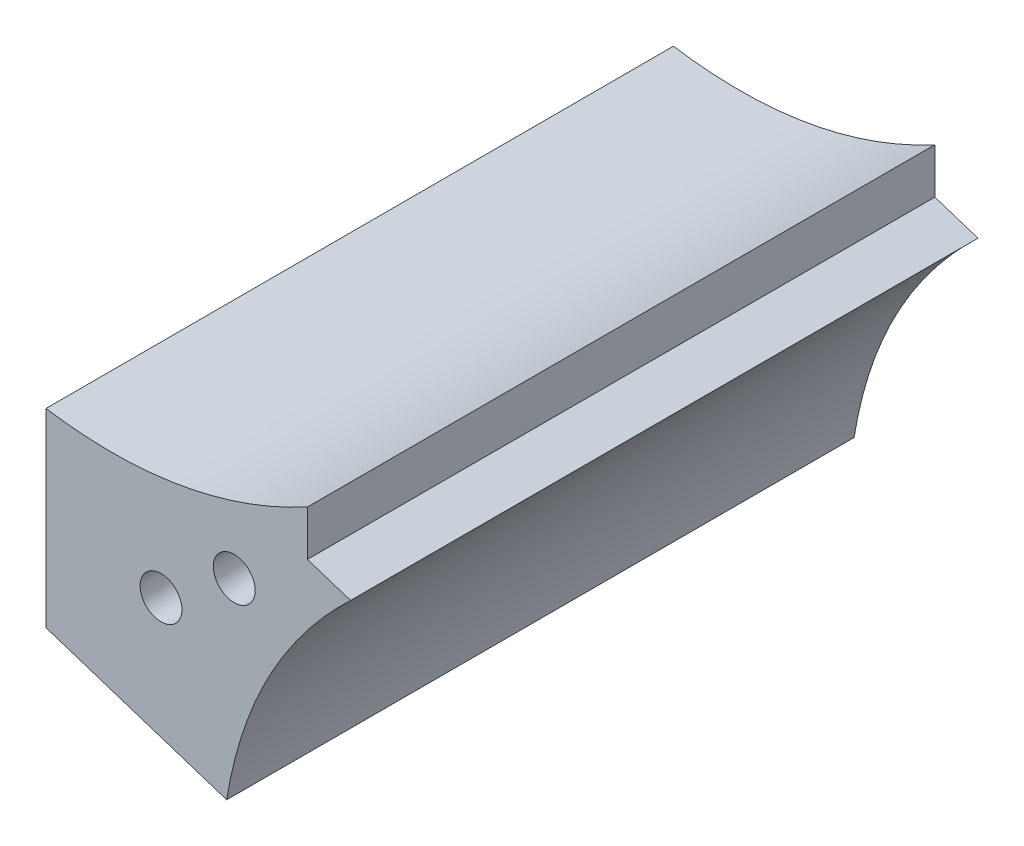
from build123d import *

# Parameters (mm, degrees)
SKETCH_1_R          = 2
EXTRUDE_1_DEPTH     = 60
CUT_EXTRUDE_1_DEPTH = 55


with BuildPart() as part:
    # 草图1 → 凸台-拉伸1 (new body)
    with BuildSketch(Plane.XY):
        with BuildLine():
            Line((10.155709238, 10.284373102), (10.155709238, 14.620809902))
            add(Edge.make_bspline(
                [(10.155709238, 14.620809902), (-1.633651532, 8.235919316), (-14.844290763, 10.284373103)],
                knots=[0, 0, 0, 1, 1, 1], degree=2))
            Line((-14.844290763, 10.284373103), (-14.844290762, -7.879190098))
            Line((-14.844290762, -7.879190098), (2.430284378, -13.492039805))
            add(Edge.make_bspline(
                [(2.430284378, -13.492039805), (4.564401085, -0.294968248), (14.279905714, 8.944340437)],
                knots=[0, 0, 0, 1, 1, 1], degree=2))
            Line((14.279905714, 8.944340437), (10.155709238, 10.284373102))
        make_face()
        with Locations((-3.844290762, 0.11277771)):
            Circle(SKETCH_1_R, mode=Mode.SUBTRACT)
        with Locations((3.155709238, 5.198575406)):
            Circle(SKETCH_1_R, mode=Mode.SUBTRACT)
    extrude(amount=EXTRUDE_1_DEPTH)

    # 草图2 → 切除-拉伸1 (cut)
    with BuildSketch(Plane(origin=(0, 0, 0), x_dir=(-1, 0, 0), z_dir=(0, 0, -1))):
        with BuildLine():
            Line((-0.804568229, 8.434643384), (6.195431771, 3.348845688))
            ThreePointArc((6.195431771, 3.348845688), (7.08035874, -2.238363299), (1.493149753, -3.123290267))
            Line((1.493149753, -3.123290267), (-5.506850247, 1.962507429))
            ThreePointArc((-5.506850247, 1.962507429), (-6.391777215, 7.549716416), (-0.804568229, 8.434643384))
        make_face()
    extrude(amount=-CUT_EXTRUDE_1_DEPTH, mode=Mode.SUBTRACT)


solid = part.part
